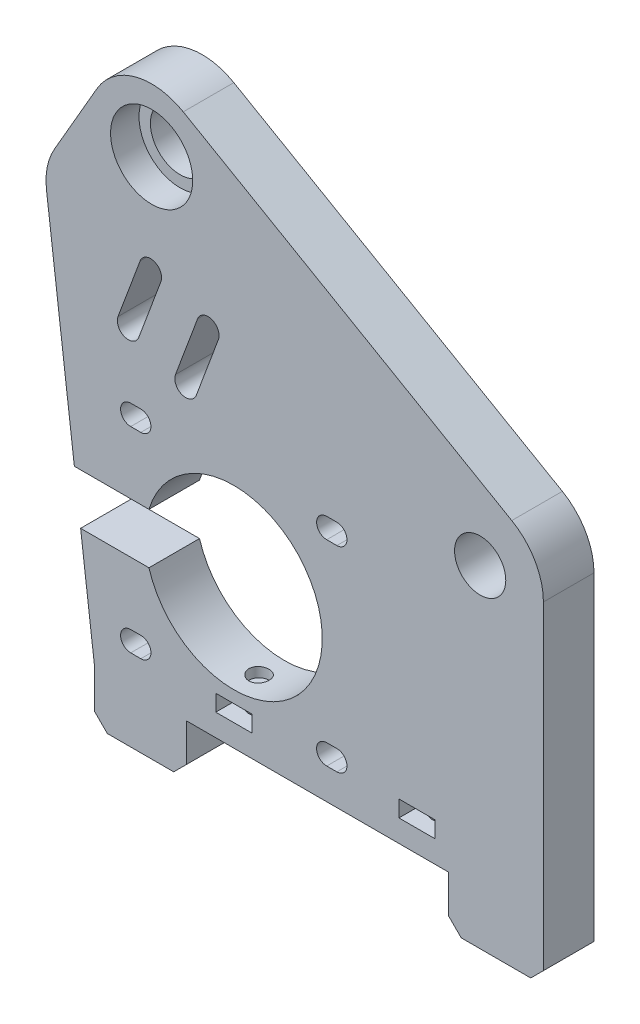
from build123d import *

# Parameters (mm, degrees)
SKETCH_3_R          = 4.05
SKETCH_3_R_2        = 4.7
SKETCH_3_W          = 6.2
SKETCH_3_H          = 3
EXTRUDE_1_DEPTH     = 8
SKETCH_4_R          = 6.5
CUT_EXTRUDE_1_DEPTH = 4.5
CUT_EXTRUDE_2_DEPTH = 3
SKETCH_6_R          = 1.6
CUT_EXTRUDE_3_DEPTH = 15
SKETCH_7_R          = 4.05
CUT_EXTRUDE_4_DEPTH = 80.802401326
CHAMFER_1_SIZE      = 2
EXTRUDE_2_DEPTH     = 8


with BuildPart() as part:
    # 草图3 → 凸台-拉伸1 (new body)
    with BuildSketch(Plane.XY):
        with BuildLine():
            Line((43.971143614, 31.160253781), (-7.990379897, 61.160256921))
            ThreePointArc((-7.990379897, 61.160256921), (-15.578570545, 62.159261468), (-21.650634379, 57.500003139))
            Line((-21.650634379, 57.500003139), (-28.355968253, 45.886024187))
            ThreePointArc((-28.355968253, 45.886024187), (-29.495746829, 42.875838443), (-29.620211311, 39.659501706))
            Line((-29.620211311, 39.659501706), (-25.213219189, 4))
            Line((-25.213219189, 4), (-13.416407865, 4))
            ThreePointArc((-13.416407865, 4), (14, 0), (-13.416407865, -4))
            Line((-13.416407865, -4), (-24.224536362, -4))
            Line((-24.224536362, -4), (-22, -22))
            Line((-22, -22), (-22, -30))
            Line((-22, -30), (-7.5, -30))
            Line((-7.5, -30), (-7.5, -22))
            Line((-7.5, -22), (33.97114317, -22))
            Line((33.97114317, -22), (33.97114317, -30))
            Line((33.97114317, -30), (48.97114317, -30))
            Line((48.97114317, -30), (48.97114317, 22.5))
            ThreePointArc((48.97114317, 22.5), (47.631397336, 27.499999778), (43.971143614, 31.160253781))
        make_face()
        with Locations((38.97114317, 22.5)):
            Circle(SKETCH_3_R, mode=Mode.SUBTRACT)
        with Locations((-12.990380341, 52.500003139)):
            Circle(SKETCH_3_R_2, mode=Mode.SUBTRACT)
        with BuildLine():
            Line((-16.3, 17.1), (-14.7, 17.1))
            ThreePointArc((-14.7, 17.1), (-13.1, 15.5), (-14.7, 13.9))
            Line((-14.7, 13.9), (-16.3, 13.9))
            ThreePointArc((-16.3, 13.9), (-17.9, 15.5), (-16.3, 17.1))
        make_face(mode=Mode.SUBTRACT)
        with BuildLine():
            Line((14.7, 17.1), (16.3, 17.1))
            ThreePointArc((16.3, 17.1), (17.9, 15.5), (16.3, 13.9))
            Line((16.3, 13.9), (14.7, 13.9))
            ThreePointArc((14.7, 13.9), (13.1, 15.5), (14.7, 17.1))
        make_face(mode=Mode.SUBTRACT)
        with BuildLine():
            Line((14.7, -13.9), (16.3, -13.9))
            ThreePointArc((16.3, -13.9), (17.9, -15.5), (16.3, -17.1))
            Line((16.3, -17.1), (14.7, -17.1))
            ThreePointArc((14.7, -17.1), (13.1, -15.5), (14.7, -13.9))
        make_face(mode=Mode.SUBTRACT)
        with BuildLine():
            Line((-16.3, -13.9), (-14.7, -13.9))
            ThreePointArc((-14.7, -13.9), (-13.1, -15.5), (-14.7, -17.1))
            Line((-14.7, -17.1), (-16.3, -17.1))
            ThreePointArc((-16.3, -17.1), (-17.9, -15.5), (-16.3, -13.9))
        make_face(mode=Mode.SUBTRACT)
        with Locations((0, -17)):
            Rectangle(SKETCH_3_W, SKETCH_3_H, mode=Mode.SUBTRACT)
        with Locations((28.97114317, -17)):
            Rectangle(SKETCH_3_W, SKETCH_3_H, mode=Mode.SUBTRACT)
    extrude(amount=EXTRUDE_1_DEPTH)

    # 草图4 → 切除-拉伸1 (cut)
    with BuildSketch(Plane(origin=(0, 0, 8), x_dir=(-1, 0, 0), z_dir=(0, 0, -1))):
        with Locations((12.990380341, 52.500003139)):
            Circle(SKETCH_4_R)
    extrude(amount=CUT_EXTRUDE_1_DEPTH, mode=Mode.SUBTRACT)

    # 草图5 → 切除-拉伸2 (cut)
    with BuildSketch(Plane.XY):
        with BuildLine():
            Line((-17.025, 18.55), (-13.975, 18.55))
            ThreePointArc((-13.975, 18.55), (-10.925, 15.5), (-13.975, 12.45))
            Line((-13.975, 12.45), (-17.025, 12.45))
            ThreePointArc((-17.025, 12.45), (-20.075, 15.5), (-17.025, 18.55))
        make_face()
        with BuildLine():
            Line((13.975, 18.55), (17.025, 18.55))
            ThreePointArc((17.025, 18.55), (20.075, 15.5), (17.025, 12.45))
            Line((17.025, 12.45), (13.975, 12.45))
            ThreePointArc((13.975, 12.45), (10.925, 15.5), (13.975, 18.55))
        make_face()
        with BuildLine():
            Line((13.975, -12.45), (17.025, -12.45))
            ThreePointArc((17.025, -12.45), (20.075, -15.5), (17.025, -18.55))
            Line((17.025, -18.55), (13.975, -18.55))
            ThreePointArc((13.975, -18.55), (10.925, -15.5), (13.975, -12.45))
        make_face()
        with BuildLine():
            Line((-17.025, -12.45), (-13.975, -12.45))
            ThreePointArc((-13.975, -12.45), (-10.925, -15.5), (-13.975, -18.55))
            Line((-13.975, -18.55), (-17.025, -18.55))
            ThreePointArc((-17.025, -18.55), (-20.075, -15.5), (-17.025, -12.45))
        make_face()
    extrude(amount=CUT_EXTRUDE_2_DEPTH, mode=Mode.SUBTRACT)

    # 草图6 → 切除-拉伸3 (cut)
    with BuildSketch(Plane.XZ.offset(22)):
        with Locations(Location((0, 4, 0), (0, 0, 270))):
            Circle(SKETCH_6_R)
        with Locations(Location((28.97114317, 4, 0), (0, 0, 270))):
            Circle(SKETCH_6_R)
    extrude(amount=-CUT_EXTRUDE_3_DEPTH, mode=Mode.SUBTRACT)

    # 草图7 → 切除-拉伸4 (cut, through all)
    with BuildSketch(Plane.XY.offset(8)):
        with Locations((38.97114317, 22.5)):
            Circle(SKETCH_7_R)
        with BuildLine():
            Line((-9.216024373, 24.574816528), (-5.72042198, 33.943955438))
            ThreePointArc((-5.72042198, 33.943955438), (-3.469092252, 34.971824328), (-2.441223361, 32.7204946))
            Line((-2.441223361, 32.7204946), (-5.936825754, 23.35135569))
            ThreePointArc((-5.936825754, 23.35135569), (-8.188156046, 22.323485289), (-9.216024373, 24.574816528))
        make_face()
        with BuildLine():
            Line((-18.304089115, 27.965550849), (-14.808486722, 37.334689759))
            ThreePointArc((-14.808486722, 37.334689759), (-12.557156994, 38.362558649), (-11.529288104, 36.111228921))
            Line((-11.529288104, 36.111228921), (-15.024890497, 26.742090011))
            ThreePointArc((-15.024890497, 26.742090011), (-17.276220788, 25.71421961), (-18.304089115, 27.965550849))
        make_face()
    extrude(amount=-CUT_EXTRUDE_4_DEPTH, mode=Mode.SUBTRACT)

    # 倒角1
    chamfer_1_edges = [part.edges().sort_by_distance(p)[0] for p in [
        (48.97114317, -30, 4),
        (33.97114317, -30, 4),
        (-7.5, -30, 4),
        (-22, -30, 4),
    ]]
    chamfer(chamfer_1_edges, length=CHAMFER_1_SIZE)

    # 草图9 → 凸台-拉伸2 (add)
    with BuildSketch(Plane.XY.offset(8)):
        Polygon((2.85, -15.9), (-2.85, -15.9), (-2.85, -18.5), (-3.1, -18.5), (-3.1, -15.5), (3.1, -15.5), (3.1, -18.5), (2.85, -18.5), align=None)
        Polygon((31.82114317, -15.9), (26.12114317, -15.9), (26.12114317, -18.5), (25.87114317, -18.5), (25.87114317, -15.5), (32.07114317, -15.5), (32.07114317, -18.5), (31.82114317, -18.5), align=None)
    extrude(amount=-EXTRUDE_2_DEPTH)


solid = part.part
